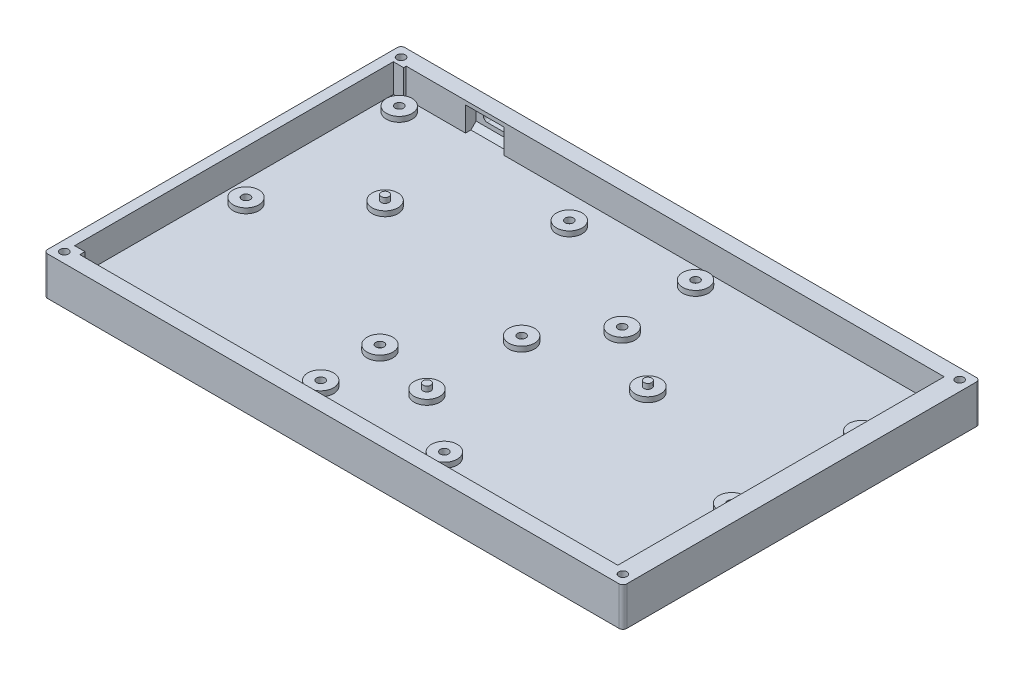
from build123d import *

# Parameters (mm, degrees)
SKETCH1_W                     = 224.81
SKETCH1_H                     = 138.7
BOTTOM_PLATE_DEPTH            = 4
SKETCH2_W                     = 8
SKETCH2_H                     = 8
SKETCH2_W_2                   = 7
SKETCH2_H_2                   = 7
SIDE_WALLS_DEPTH              = 11
SKETCH11_W                    = 4
SKETCH11_H                    = 123.7
USB_CUTOUT_DEPTH              = 11
CSK_FOR_M3_SFHCS1_D           = 3.2
CSK_FOR_M3_SFHCS1_CSINK_D     = 6.72
CSK_FOR_M3_SFHCS1_CSINK_ANGLE = 90
FILLET1_R                     = 1.5
USB_C_PORT_DEPTH              = 10
SKETCH18_W                    = 15
SKETCH18_H                    = 4.1
BOSS_EXTRUDE1_DEPTH           = 1.5
CHAMFER1_SIZE                 = 2
SKETCH16_R                    = 5
PCB_SUPPORT_DEPTH             = 2
SKETCH17_R                    = 1.5
ALIGNMENT_POSTS_DEPTH         = 2
SKETCH20_R                    = 1.6
PCB_SCREW_CLEARANCE_DEPTH     = 2.15
SKETCH21_W                    = 5.5
SKETCH21_H                    = 5.5
CUT_EXTRUDE2_DEPTH            = 1.8


with BuildPart() as part:
    # Sketch1 → bottom_plate (new body)
    with BuildSketch(Plane(origin=(0, 0, 0), x_dir=(1, 0, 0), z_dir=(0, 1, 0))):
        with Locations((157.396993286, 282.353126042)):
            Rectangle(SKETCH1_W, SKETCH1_H)
    extrude(amount=BOTTOM_PLATE_DEPTH)

    # Sketch2 → side_walls (add)
    with BuildSketch(Plane(origin=(0, 4, 0), x_dir=(1, 0, 0), z_dir=(0, 1, 0))):
        with Locations((48.991993286, 217.003126042)):
            Rectangle(SKETCH2_W, SKETCH2_H)
        with Locations((266.301993286, 216.503126042)):
            Rectangle(SKETCH2_W_2, SKETCH2_H_2)
        with Locations((266.301993286, 348.203126042)):
            Rectangle(SKETCH2_W_2, SKETCH2_H_2)
        with Locations((48.991993286, 348.203126042)):
            Rectangle(SKETCH2_W, SKETCH2_H_2)
    extrude(amount=SIDE_WALLS_DEPTH)

    # Sketch11 → usb_cutout (add)
    with BuildSketch(Plane(origin=(0, 4, 0), x_dir=(1, 0, 0), z_dir=(0, 1, 0))):
        with Locations((46.991993286, 282.853126042)):
            Rectangle(SKETCH11_W, SKETCH11_H)
        Polygon((52.991993286, 213.003126042), (262.801993286, 213.003126042), (262.801993286, 219.003126042), (269.801993286, 219.003126042), (269.801993286, 345.703126042), (262.801993286, 345.703126042), (262.801993286, 351.703126042), (52.991993286, 351.703126042), (52.991993286, 345.703126042), (75.991993286, 345.703126042), (75.991993286, 349.803126042), (90.991993286, 349.803126042), (90.991993286, 345.703126042), (261.801993286, 345.703126042), (261.801993286, 219.003126042), (52.991993286, 219.003126042), align=None)
    extrude(amount=USB_CUTOUT_DEPTH)

    # CSK for M3 SFHCS1 (through all)
    with Locations(Plane(origin=(0, 0, 0), x_dir=(-1, 0, 0), z_dir=(0, -1, 0))):
        with Locations((-48.991993286, 217.003686618), (-265.799879733, 217.003686618), (-265.799879733, 347.703126042), (-48.991993286, 347.703126042)):
            CounterSinkHole(CSK_FOR_M3_SFHCS1_D / 2, CSK_FOR_M3_SFHCS1_CSINK_D / 2, counter_sink_angle=CSK_FOR_M3_SFHCS1_CSINK_ANGLE)

    # Fillet1
    fillet1_edges = [part.edges().sort_by_distance(p)[0] for p in [
        (44.991993286, 7.5, -351.703126042),
        (269.801993286, 7.5, -351.703126042),
        (269.801993286, 7.5, -213.003126042),
        (44.991993286, 7.5, -213.003126042),
    ]]
    fillet(fillet1_edges, radius=FILLET1_R)

    # Sketch14 → usb-c port (cut)
    with BuildSketch(Plane.XY.offset(-349.803126042)):
        with BuildLine():
            Line((80.300245901, 7.7), (86.470717131, 7.7))
            ThreePointArc((86.470717131, 7.7), (87.531377303, 8.139339828), (87.970717131, 9.2))
            Line((87.970717131, 9.2), (87.970717131, 9.590467347))
            ThreePointArc((87.970717131, 9.590467347), (87.531377303, 10.651127519), (86.470717131, 11.090467347))
            Line((86.470717131, 11.090467347), (80.300245901, 11.090467347))
            ThreePointArc((80.300245901, 11.090467347), (79.239585729, 10.651127519), (78.800245901, 9.590467347))
            Line((78.800245901, 9.590467347), (78.800245901, 9.2))
            ThreePointArc((78.800245901, 9.2), (79.239585729, 8.139339828), (80.300245901, 7.7))
        make_face()
    extrude(amount=-USB_C_PORT_DEPTH, mode=Mode.SUBTRACT)

    # Sketch18 → Boss-Extrude1 (add)
    with BuildSketch(Plane(origin=(0, 15, 0), x_dir=(1, 0, 0), z_dir=(0, 1, 0))):
        with Locations((83.491993286, 347.753126042)):
            Rectangle(SKETCH18_W, SKETCH18_H)
    extrude(amount=-BOSS_EXTRUDE1_DEPTH)

    # Chamfer1
    chamfer1_edges = [part.edges().sort_by_distance(p)[0] for p in [
        (83.491993286, 13.5, -349.803126042),
        (83.491993286, 4, -349.803126042),
    ]]
    chamfer(chamfer1_edges, length=CHAMFER1_SIZE)

    # Sketch16 → pcb_support (add)
    with BuildSketch(Plane(origin=(0, 4, 0), x_dir=(1, 0, 0), z_dir=(0, 1, 0))):
        with Locations(Location((55.991993286, 340.003687101, 0), (0, 0, 90))):
            Circle(SKETCH16_R)
        with Locations(Location((56.991993286, 279.503687101, 0), (0, 0, 90))):
            Circle(SKETCH16_R)
        with Locations(Location((132.491993286, 256.003687101, 0), (0, 0, 90))):
            Circle(SKETCH16_R)
        with Locations(Location((253.991993286, 271.003687101, 0), (0, 0, 90))):
            Circle(SKETCH16_R)
        with Locations(Location((254.991993286, 320.503687101, 0), (0, 0, 90))):
            Circle(SKETCH16_R)
        with Locations(Location((156.991993286, 286.503687101, 0), (0, 0, 90))):
            Circle(SKETCH16_R)
        with Locations(Location((171.991993286, 339.003687101, 0), (0, 0, 90))):
            Circle(SKETCH16_R)
        with Locations(Location((127.491993286, 334.503687101, 0), (0, 0, 90))):
            Circle(SKETCH16_R)
        with Locations(Location((173.491993286, 309.003687101, 0), (0, 0, 90))):
            Circle(SKETCH16_R)
        with Locations(Location((198.491993286, 294.003687101, 0), (0, 0, 90))):
            Circle(SKETCH16_R)
        with Locations(Location((180.991993286, 232.503687101, 0), (0, 0, 90))):
            Circle(SKETCH16_R)
        with Locations(Location((84.991993286, 305.503687101, 0), (0, 0, 90))):
            Circle(SKETCH16_R)
        with Locations(Location((156.491993286, 250.253687101, 0), (0, 0, 90))):
            Circle(SKETCH16_R)
        with Locations(Location((132.991993286, 232.503687101, 0), (0, 0, 90))):
            Circle(SKETCH16_R)
    extrude(amount=PCB_SUPPORT_DEPTH)

    # Sketch17 → alignment_posts (add)
    with BuildSketch(Plane(origin=(0, 6, 0), x_dir=(1, 0, 0), z_dir=(0, 1, 0))):
        with Locations(Location((84.991993286, 305.503687101, 0), (0, 0, 270))):
            Circle(SKETCH17_R)
        with Locations(Location((198.491993286, 294.003687101, 0), (0, 0, 270))):
            Circle(SKETCH17_R)
        with Locations(Location((156.491993286, 250.253687101, 0), (0, 0, 270))):
            Circle(SKETCH17_R)
    extrude(amount=ALIGNMENT_POSTS_DEPTH)

    # Sketch20 → pcb screw clearance (cut)
    with BuildSketch(Plane(origin=(0, 6, 0), x_dir=(1, 0, 0), z_dir=(0, 1, 0))):
        with Locations(Location((55.991993286, 340.003687101, 0), (0, 0, 270))):
            Circle(SKETCH20_R)
        with Locations(Location((127.491993286, 334.503687101, 0), (0, 0, 270))):
            Circle(SKETCH20_R)
        with Locations(Location((56.991993286, 279.503687101, 0), (0, 0, 270))):
            Circle(SKETCH20_R)
        with Locations(Location((132.491993286, 256.003687101, 0), (0, 0, 270))):
            Circle(SKETCH20_R)
        with Locations(Location((132.991993286, 232.503687101, 0), (0, 0, 270))):
            Circle(SKETCH20_R)
        with Locations(Location((180.991993286, 232.503687101, 0), (0, 0, 270))):
            Circle(SKETCH20_R)
        with Locations(Location((156.991993286, 286.503687101, 0), (0, 0, 270))):
            Circle(SKETCH20_R)
        with Locations(Location((253.991993286, 271.003687101, 0), (0, 0, 270))):
            Circle(SKETCH20_R)
        with Locations(Location((173.491993286, 309.003687101, 0), (0, 0, 270))):
            Circle(SKETCH20_R)
        with Locations(Location((171.991993286, 339.003687101, 0), (0, 0, 270))):
            Circle(SKETCH20_R)
        with Locations(Location((254.991993286, 320.503687101, 0), (0, 0, 270))):
            Circle(SKETCH20_R)
    extrude(amount=-PCB_SCREW_CLEARANCE_DEPTH, mode=Mode.SUBTRACT)

    # Sketch21 → Cut-Extrude2 (cut)
    with BuildSketch(Plane(origin=(0, 3.85, 0), x_dir=(1, 0, 0), z_dir=(0, 1, 0))):
        with Locations((55.991993286, 340.003687101)):
            Rectangle(SKETCH21_W, SKETCH21_H)
        with Locations((127.491993286, 334.503687101)):
            Rectangle(SKETCH21_W, SKETCH21_H)
        with Locations((56.991993286, 279.503687101)):
            Rectangle(SKETCH21_W, SKETCH21_H)
        with Locations((132.491993286, 256.003687101)):
            Rectangle(SKETCH21_W, SKETCH21_H)
        with Locations((132.991993286, 232.503687101)):
            Rectangle(SKETCH21_W, SKETCH21_H)
        with Locations((180.991993286, 232.503687101)):
            Rectangle(SKETCH21_W, SKETCH21_H)
        with Locations((253.991993286, 271.003687101)):
            Rectangle(SKETCH21_W, SKETCH21_H)
        with Locations((173.491993286, 309.003687101)):
            Rectangle(SKETCH21_W, SKETCH21_H)
        with Locations((171.991993286, 339.003687101)):
            Rectangle(SKETCH21_W, SKETCH21_H)
        with Locations((254.991993286, 320.503687101)):
            Rectangle(SKETCH21_W, SKETCH21_H)
    extrude(amount=-CUT_EXTRUDE2_DEPTH, mode=Mode.SUBTRACT)


solid = part.part
